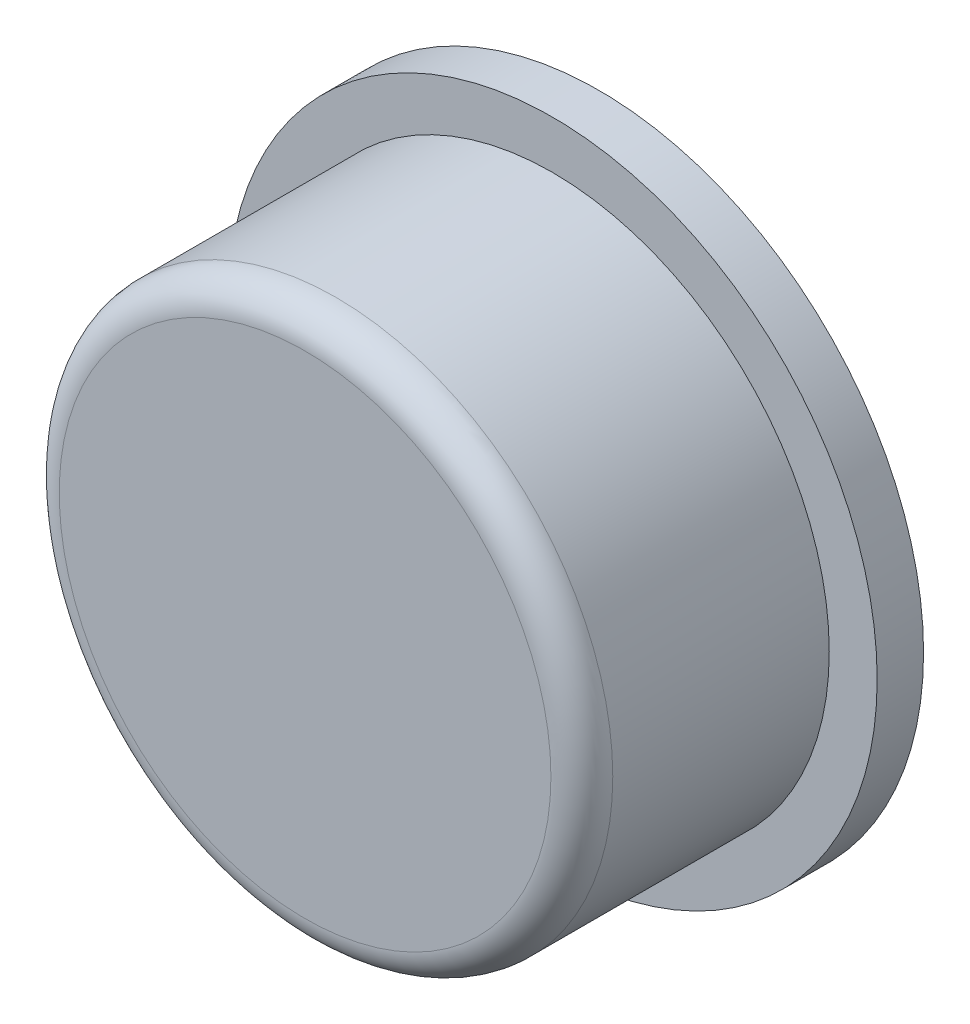
from build123d import *


with BuildPart() as part:
    # Sketch1 → Revolve1 (revolve)
    with BuildSketch(Plane(origin=(0, 0, 0), x_dir=(1, 0, 0), z_dir=(0, 1, 0))):
        with BuildLine():
            Line((0, 0), (7.95, 0))
            ThreePointArc((7.95, 0), (8.657106781, 0.292893219), (8.95, 1))
            Line((8.95, 1), (8.95, 8))
            Line((8.95, 8), (10.5, 8))
            Line((10.5, 8), (10.5, 9.5))
            Line((10.5, 9.5), (3.708099244, 9.5))
            ThreePointArc((3.708099244, 9.5), (2.236067977, 11.31662479), (0, 12))
            Line((0, 12), (0, 0))
        make_face()
    revolve(axis=Axis((0, 0, 0), (0, 0, -1)))


solid = part.part
